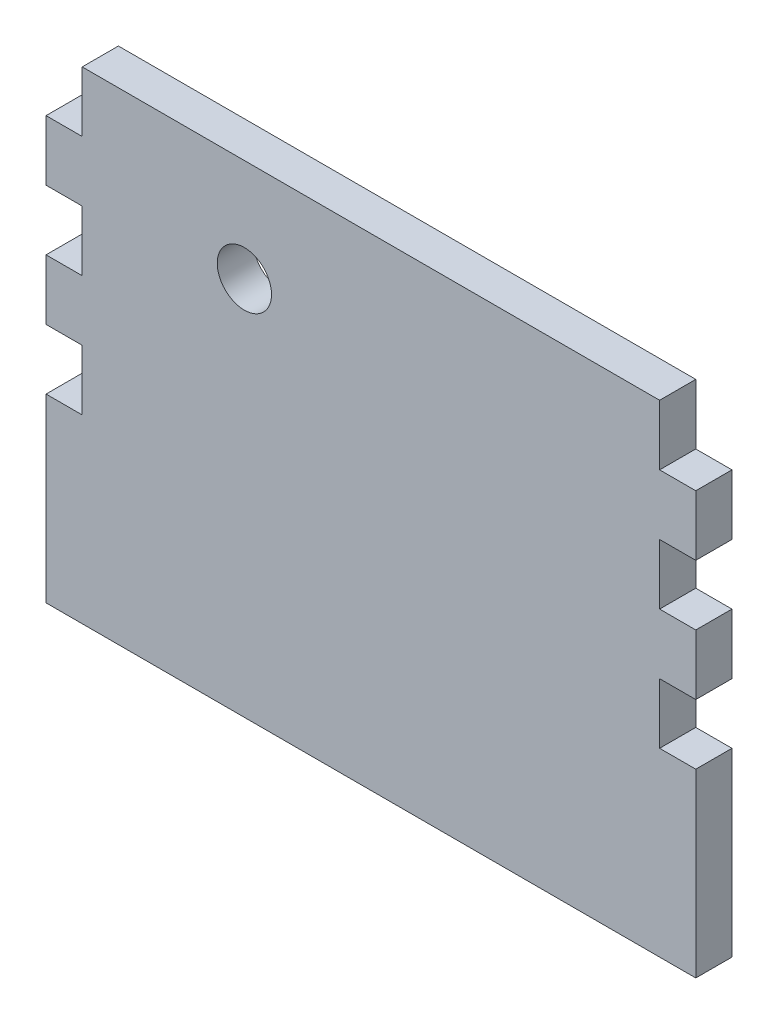
from build123d import *

# Parameters (mm, degrees)
SKETCH1_W           = 53.89
SKETCH1_H           = 40
BOSS_EXTRUDE1_DEPTH = 3
SKETCH2_R           = 2.25
SKETCH2_W           = 3
SKETCH2_H           = 5
CUT_EXTRUDE1_DEPTH  = 3


with BuildPart() as part:
    # Sketch1 → Boss-Extrude1 (new body)
    with BuildSketch(Plane.XY):
        Rectangle(SKETCH1_W, SKETCH1_H)
    extrude(amount=BOSS_EXTRUDE1_DEPTH)

    # Sketch2 → Cut-Extrude1 (cut)
    with BuildSketch(Plane.XY.offset(3)):
        with Locations((-10.495, 11.5)):
            Circle(SKETCH2_R)
        with Locations((-25.445, 17.5)):
            Rectangle(SKETCH2_W, SKETCH2_H)
        with Locations((-25.445, 7.5)):
            Rectangle(SKETCH2_W, SKETCH2_H)
        with Locations((25.445, 17.5)):
            Rectangle(SKETCH2_W, SKETCH2_H)
        with Locations((25.445, 7.5)):
            Rectangle(SKETCH2_W, SKETCH2_H)
        with Locations((25.445, -2.5)):
            Rectangle(SKETCH2_W, SKETCH2_H)
        with Locations((-25.445, -2.5)):
            Rectangle(SKETCH2_W, SKETCH2_H)
    extrude(amount=-CUT_EXTRUDE1_DEPTH, mode=Mode.SUBTRACT)


solid = part.part
